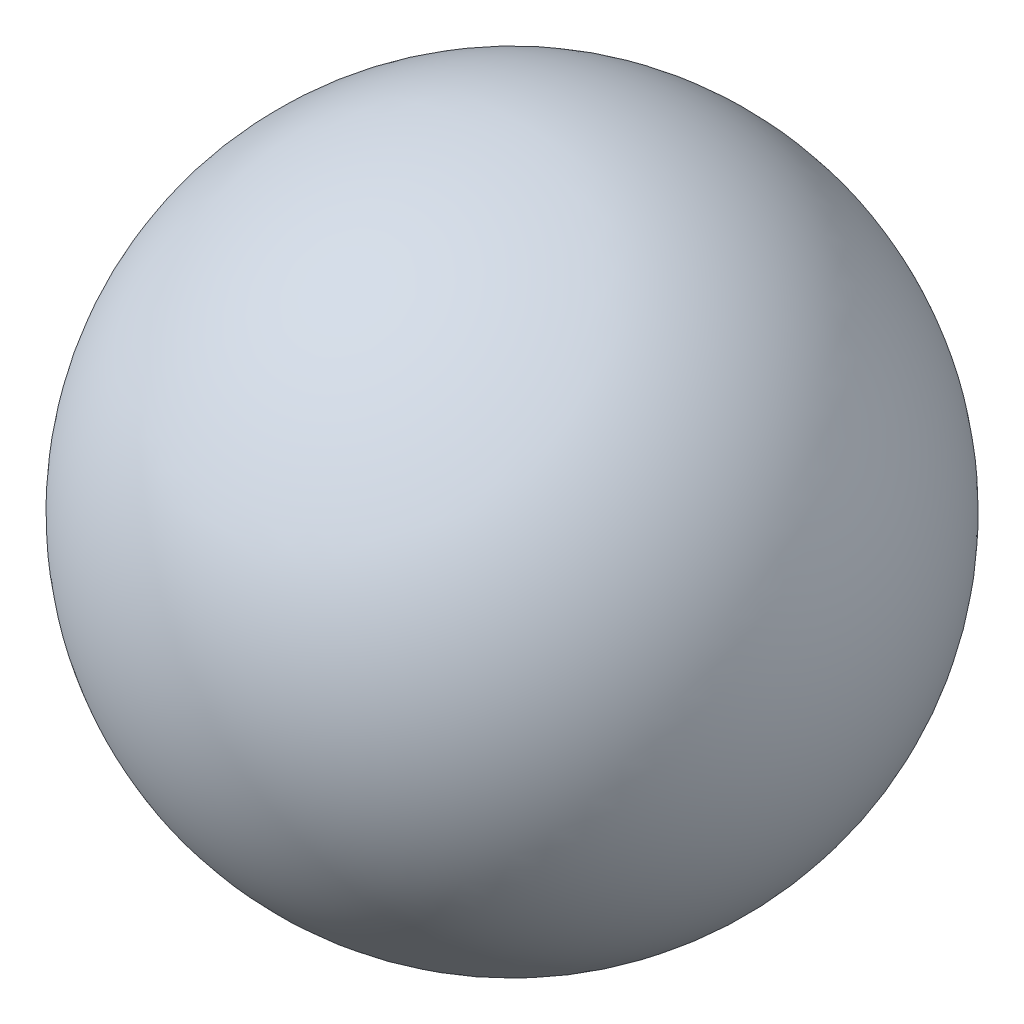
from build123d import *


with BuildPart() as part:
    # Sketch1 → Revolve4 (revolve)
    with BuildSketch(Plane(origin=(0, 0, 0), x_dir=(1, 0, 0), z_dir=(0, 1, 0))):
        with BuildLine():
            Line((0, 34.29), (0, -34.29))
            ThreePointArc((0, -34.29), (34.29, 0), (0, 34.29))
        make_face()
    revolve(axis=Axis((0, 0, 34.29), (0, 0, -1)))


solid = part.part
